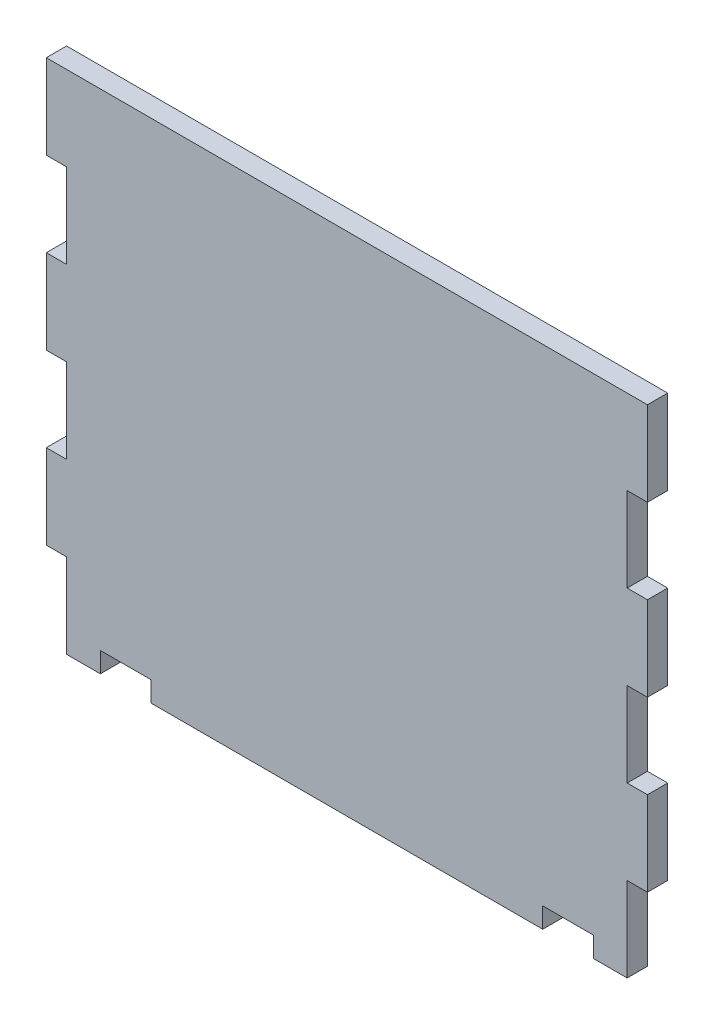
from build123d import *

# Parameters (mm, degrees)
SKETCH1_W            = 178
SKETCH1_H            = 150
BOSS_EXTRUDE1_DEPTH  = 6
SKETCH2_W            = 6
SKETCH2_H            = 25
CUT_EXTRUDE1_DEPTH   = 6
LPATTERN1_COUNT      = 3
LPATTERN1_PITCH      = 50
LPATTERN1_COUNT_DIR2 = 2
LPATTERN1_PITCH_DIR2 = 172
SKETCH3_W            = 15
SKETCH3_H            = 6
CUT_EXTRUDE2_DEPTH   = 233.851884253


with BuildPart() as part:
    # Sketch1 → Boss-Extrude1 (new body)
    with BuildSketch(Plane.XY):
        with Locations((-89, 75)):
            Rectangle(SKETCH1_W, SKETCH1_H)
    extrude(amount=BOSS_EXTRUDE1_DEPTH)

    # Sketch2 → Cut-Extrude1 (cut)
    with BuildSketch(Plane.XY.offset(6)):
        with Locations((-175, 112.5)):
            Rectangle(SKETCH2_W, SKETCH2_H)
    cut_extrude1 = extrude(amount=-CUT_EXTRUDE1_DEPTH, mode=Mode.SUBTRACT)

    # LPattern1: Cut-Extrude1 3 × 2
    with Locations(*[(j * LPATTERN1_PITCH_DIR2, -i * LPATTERN1_PITCH, 0) for i in range(LPATTERN1_COUNT) for j in range(LPATTERN1_COUNT_DIR2) if (i, j) != (0, 0)]):
        add(cut_extrude1, mode=Mode.SUBTRACT)

    # Sketch3 → Cut-Extrude2 (cut, through all)
    with BuildSketch(Plane.XY.offset(6)):
        with Locations((-23.5, 3)):
            Rectangle(SKETCH3_W, SKETCH3_H)
        with Locations((-154.5, 3)):
            Rectangle(SKETCH3_W, SKETCH3_H)
    extrude(amount=-CUT_EXTRUDE2_DEPTH, mode=Mode.SUBTRACT)


solid = part.part
